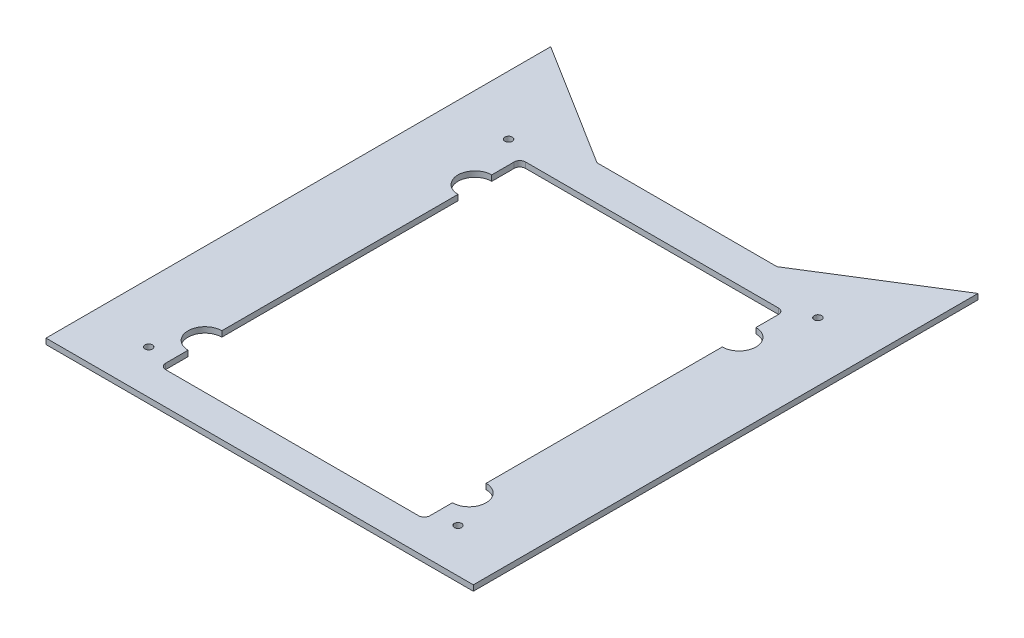
from build123d import *

# Parameters (mm, degrees)
SKETCH1_W           = 63.5
SKETCH1_H           = 190.5
BOSS_EXTRUDE1_DEPTH = 3.175
SKETCH3_R           = 2.0828
CUT_EXTRUDE2_DEPTH  = 526.850378691
SKETCH4_R           = 2.0828
CUT_EXTRUDE4_DEPTH  = 526.850378691
FILLET2_R           = 3.175
CUT_EXTRUDE5_DEPTH  = 526.850378691


with BuildPart() as part:
    # Sketch1 → Boss-Extrude1 (new body)
    with BuildSketch(Plane(origin=(0, 0, 0), x_dir=(1, 0, 0), z_dir=(0, 1, 0))):
        Polygon((-242.686835374, -133.432512515), (-242.686835374, -385.491221995), (-242.686835374, -387.371651362), (-191.886835374, -438.171651362), (239.913164626, -438.171651362), (290.713164626, -387.371651362), (290.713164626, -133.371651362), (176.413164626, -82.571651362), (176.413164626, -133.371651362), (74.813164626, -196.871651362), (-26.786835374, -196.871651362), (-128.386835374, -133.371651362), (-128.386835374, -82.571651362), (-242.686835374, -133.371651362), align=None)
        with Locations((233.563164626, -243.80020948)):
            Rectangle(SKETCH1_W, SKETCH1_H, mode=Mode.SUBTRACT)
        with Locations((-185.536835374, -243.80020948)):
            Rectangle(SKETCH1_W, SKETCH1_H, mode=Mode.SUBTRACT)
    extrude(amount=BOSS_EXTRUDE1_DEPTH)

    # Sketch3 → Cut-Extrude2 (cut, through all)
    with BuildSketch(Plane(origin=(0, 0, 0), x_dir=(1, 0, 0), z_dir=(0, 1, 0))):
        with Locations(Location((-114.278235374, -270.125471314, 0), (0, 0, 270))):
            Circle(SKETCH3_R)
        with Locations(Location((-143.449035374, -284.13540948, 0), (0, 0, 270))):
            Circle(SKETCH3_R)
        with Locations(Location((-114.278235374, -217.474947647, 0), (0, 0, 270))):
            Circle(SKETCH3_R)
        with Locations(Location((-143.449035374, -203.46500948, 0), (0, 0, 270))):
            Circle(SKETCH3_R)
        with Locations(Location((191.475364626, -284.13540948, 0), (0, 0, 270))):
            Circle(SKETCH3_R)
        with Locations(Location((162.304564626, -270.125471314, 0), (0, 0, 270))):
            Circle(SKETCH3_R)
        with Locations(Location((162.304564626, -217.474947647, 0), (0, 0, 270))):
            Circle(SKETCH3_R)
        with Locations(Location((191.475364626, -203.46500948, 0), (0, 0, 270))):
            Circle(SKETCH3_R)
    extrude(amount=CUT_EXTRUDE2_DEPTH, mode=Mode.SUBTRACT)

    # Sketch4 → Cut-Extrude4 (cut, through all)
    with BuildSketch(Plane(origin=(0, 0, 0), x_dir=(1, 0, 0), z_dir=(0, 1, 0))):
        with Locations(Location((111.325664626, -210.298576853, 0), (0, 0, 270))):
            Circle(SKETCH4_R)
        with Locations(Location((111.325664626, -413.498576853, 0), (0, 0, 270))):
            Circle(SKETCH4_R)
        with Locations(Location((-63.299335374, -413.498576853, 0), (0, 0, 90))):
            Circle(SKETCH4_R)
        with Locations(Location((-63.299335374, -210.298576853, 0), (0, 0, 90))):
            Circle(SKETCH4_R)
        with BuildLine():
            Line((-50.599335374, -216.648576853), (98.625664626, -216.648576853))
            Line((98.625664626, -216.648576853), (98.625664626, -232.523576853))
            ThreePointArc((98.625664626, -232.523576853), (108.150664626, -242.048576853), (98.625664626, -251.573576853))
            Line((98.625664626, -251.573576853), (98.625664626, -384.923576853))
            ThreePointArc((98.625664626, -384.923576853), (108.150664626, -394.448576853), (98.625664626, -403.973576853))
            Line((98.625664626, -403.973576853), (98.625664626, -419.848576853))
            Line((98.625664626, -419.848576853), (-50.599335374, -419.848576853))
            Line((-50.599335374, -419.848576853), (-50.599335374, -403.973576853))
            ThreePointArc((-50.599335374, -403.973576853), (-60.124335374, -394.448576853), (-50.599335374, -384.923576853))
            Line((-50.599335374, -384.923576853), (-50.599335374, -251.573576853))
            ThreePointArc((-50.599335374, -251.573576853), (-60.124335374, -242.048576853), (-50.599335374, -232.523576853))
            Line((-50.599335374, -232.523576853), (-50.599335374, -216.648576853))
        make_face()
    extrude(amount=CUT_EXTRUDE4_DEPTH, mode=Mode.SUBTRACT)

    # Fillet2
    fillet2_edges = [part.edges().sort_by_distance(p)[0] for p in [
        (98.625664626, 1.5875, 419.848576853),
        (98.625664626, 1.5875, 216.648576853),
        (-50.599335374, 1.5875, 216.648576853),
        (-50.599335374, 1.5875, 419.848576853),
    ]]
    fillet(fillet2_edges, radius=FILLET2_R)

    # Sketch6 → Cut-Extrude5 (cut, through all)
    with BuildSketch(Plane(origin=(0, 3.175, 0), x_dir=(1, 0, 0), z_dir=(0, 1, 0))):
        Polygon((-96.636835374, -438.171651362), (-191.886835374, -438.171651362), (-242.686835374, -387.371651362), (-242.686835374, -133.371651362), (-128.386835374, -82.571651362), (-128.386835374, -133.371651362), (-96.636835374, -153.215401362), align=None)
        Polygon((176.413164626, -133.371651362), (144.663164626, -153.215401362), (144.663164626, -438.171651362), (239.913164626, -438.171651362), (290.713164626, -387.371651362), (290.713164626, -133.371651362), (176.413164626, -82.571651362), align=None)
    extrude(amount=-CUT_EXTRUDE5_DEPTH, mode=Mode.SUBTRACT)


solid = part.part
